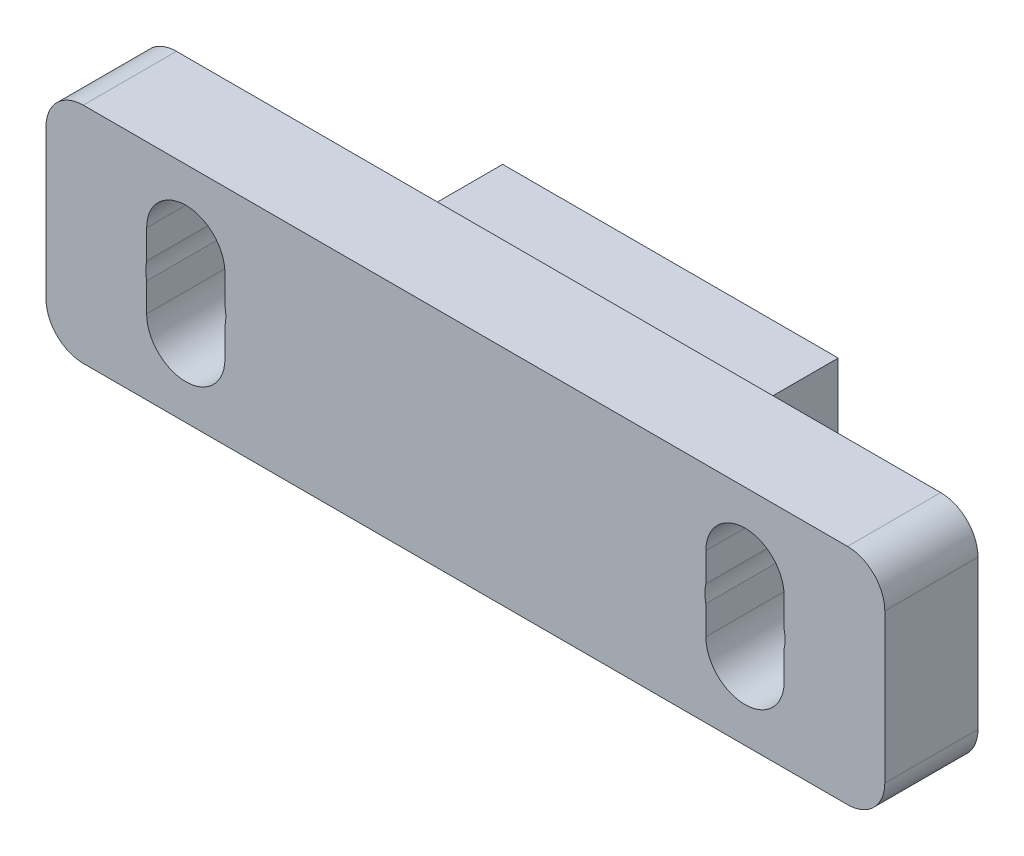
from build123d import *

# Parameters (mm, degrees)
SKETCH1_W           = 45
SKETCH1_H           = 12
SKETCH1_R           = 2.15
BOSS_EXTRUDE1_DEPTH = 5
CUT_EXTRUDE1_DEPTH  = 24.817010728
SKETCH3_W           = 18
SKETCH3_H           = 9.5
BOSS_EXTRUDE2_DEPTH = 6
FILLET1_R           = 2


with BuildPart() as part:
    # Sketch1 → Boss-Extrude1 (new body)
    with BuildSketch(Plane.XY):
        Rectangle(SKETCH1_W, SKETCH1_H)
        with Locations((-15, 0)):
            Circle(SKETCH1_R, mode=Mode.SUBTRACT)
        with Locations((15, 0)):
            Circle(SKETCH1_R, mode=Mode.SUBTRACT)
    extrude(amount=BOSS_EXTRUDE1_DEPTH)

    # Sketch2 → Cut-Extrude1 (cut, through all)
    with BuildSketch(Plane.XY.offset(5)):
        with BuildLine():
            Line((-12.9, 2), (-12.9, -2))
            ThreePointArc((-12.9, -2), (-15, -4.1), (-17.1, -2))
            Line((-17.1, -2), (-17.1, 2))
            ThreePointArc((-17.1, 2), (-15, 4.1), (-12.9, 2))
        make_face()
        with BuildLine():
            Line((12.9, -2), (12.9, 2))
            ThreePointArc((12.9, 2), (15, 4.1), (17.1, 2))
            Line((17.1, 2), (17.1, -2))
            ThreePointArc((17.1, -2), (15, -4.1), (12.9, -2))
        make_face()
    extrude(amount=-CUT_EXTRUDE1_DEPTH, mode=Mode.SUBTRACT)

    # Sketch3 → Boss-Extrude2 (add)
    with BuildSketch(Plane.XY):
        with Locations((0, -1.25)):
            Rectangle(SKETCH3_W, SKETCH3_H)
    extrude(amount=-BOSS_EXTRUDE2_DEPTH)

    # Fillet1
    fillet1_edges = [part.edges().sort_by_distance(p)[0] for p in [
        (-22.5, 6, 2.5),
        (-22.5, -6, 2.5),
        (22.5, -6, 2.5),
        (22.5, 6, 2.5),
    ]]
    fillet(fillet1_edges, radius=FILLET1_R)


solid = part.part
